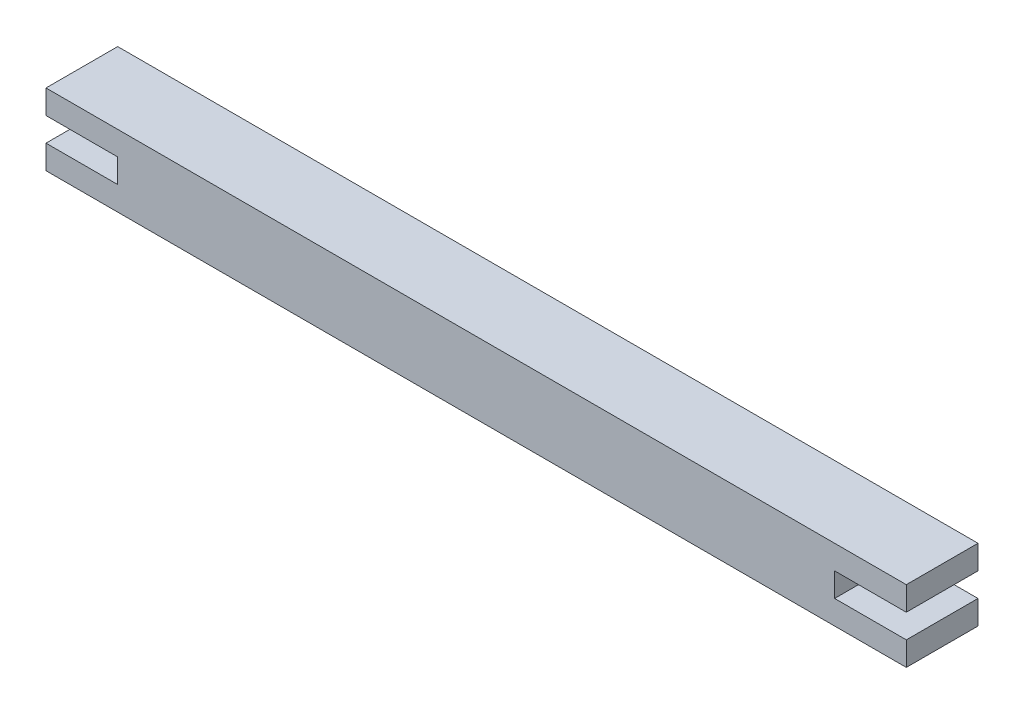
from build123d import *

# Parameters (mm, degrees)
CROQUIS1_W              = 300
CROQUIS1_H              = 30
SALIENTE_EXTRUIR1_DEPTH = 15
SALIENTE_EXTRUIR2_START = 10
CROQUIS2_W              = 360
CROQUIS2_H              = 30
SALIENTE_EXTRUIR2_DEPTH = 5


with BuildPart() as part:
    # Croquis1 → Saliente-Extruir1 (new, symmetric)
    with BuildSketch(Plane(origin=(0, 0, 0), x_dir=(1, 0, 0), z_dir=(0, 1, 0))):
        with Locations((0, 215)):
            Rectangle(CROQUIS1_W, CROQUIS1_H)
    extrude(amount=SALIENTE_EXTRUIR1_DEPTH, both=True)

    # Croquis2 → Saliente-Extruir2 (add, symmetric)
    with BuildSketch(Plane(origin=(0, 0, 0), x_dir=(1, 0, 0), z_dir=(0, 1, 0)).offset(SALIENTE_EXTRUIR2_START)):
        with Locations((0, 215)):
            Rectangle(CROQUIS2_W, CROQUIS2_H)
    saliente_extruir2 = extrude(amount=SALIENTE_EXTRUIR2_DEPTH, both=True)

    # Simetría1: Saliente-Extruir2 across plane
    add(saliente_extruir2.mirror(Plane.ZX))


solid = part.part
